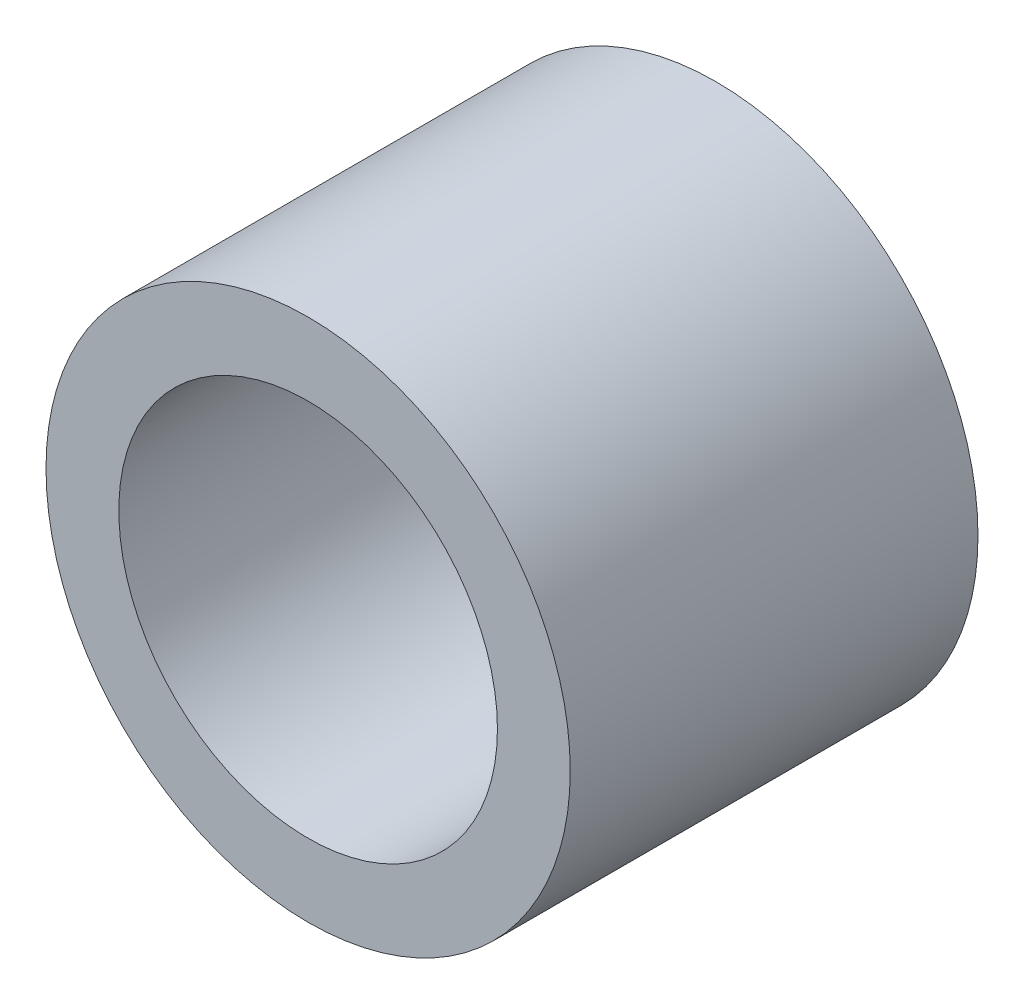
from build123d import *

# Parameters (mm, degrees)
SKETCH_1_R      = 4.5
SKETCH_1_R_2    = 3.25
EXTRUDE_1_DEPTH = 7


with BuildPart() as part:
    # ｽｹｯﾁ1 → ﾎﾞｽ - 押し出し1 (new body)
    with BuildSketch(Plane.XY):
        Circle(SKETCH_1_R)
        Circle(SKETCH_1_R_2, mode=Mode.SUBTRACT)
    extrude(amount=EXTRUDE_1_DEPTH)


solid = part.part
